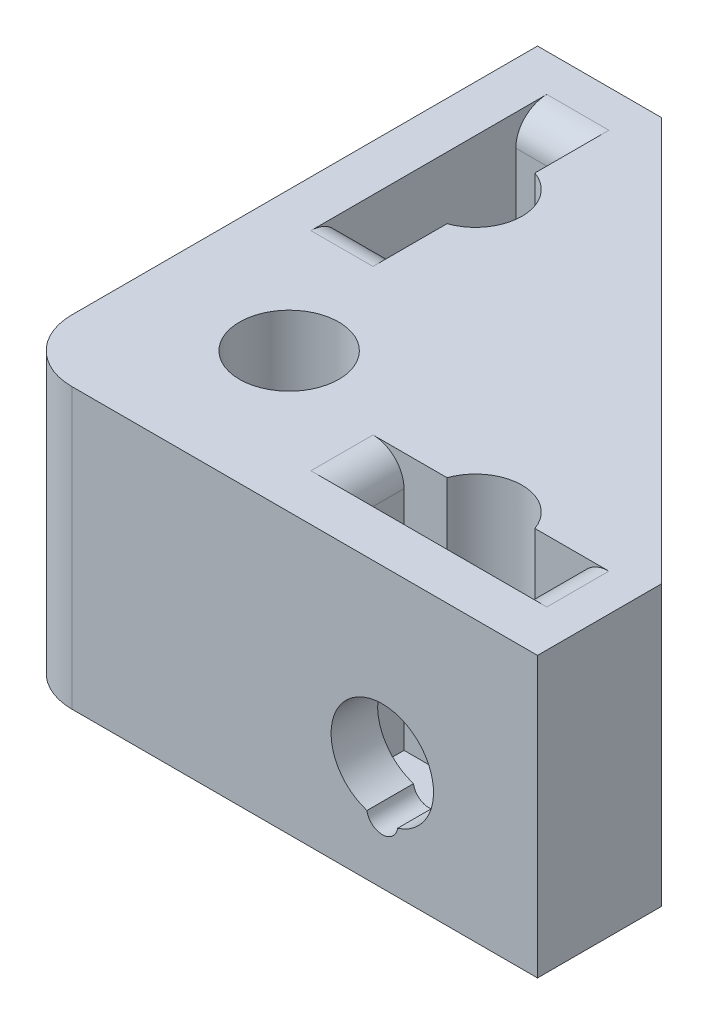
from build123d import *

# Parameters (mm, degrees)
BOSS_EXTRUDE1_DEPTH     = 9
SKETCH2_W               = 5.6
SKETCH2_H               = 2
CUT_EXTRUDE1_DEPTH      = 8.3
CUT_EXTRUDE2_DEPTH      = 22.914607001
CUT_EXTRUDE5_REACH      = 23.915
CUT_EXTRUDE5_END_RADIUS = 1.65
SKETCH16_R              = 1.5
FILLET2_R               = 1
SKETCH6_R               = 1.6
CUT_EXTRUDE3_DEPTH      = 22.914607049
CUT_EXTRUDE4_DEPTH      = 3
FILLET3_R               = 1
FILLET1_R               = 2


with BuildPart() as part:
    # Sketch1 → Boss-Extrude1 (new body)
    with BuildSketch(Plane(origin=(0, 0, 0), x_dir=(1, 0, 0), z_dir=(0, 1, 0))):
        Polygon((10.5, 10.5), (17, 4), (17, 0), (0, 0), align=None)
    extrude(amount=BOSS_EXTRUDE1_DEPTH)

    # Sketch2 → Cut-Extrude1 (cut)
    with BuildSketch(Plane(origin=(0, 9, 0), x_dir=(1, 0, 0), z_dir=(0, 1, 0))):
        with Locations((12, 2.5)):
            Rectangle(SKETCH2_W, SKETCH2_H)
    extrude(amount=-CUT_EXTRUDE1_DEPTH, mode=Mode.SUBTRACT)

    # Sketch4 → Cut-Extrude2 (cut, through all)
    with BuildSketch(Plane.XY):
        with BuildLine():
            ThreePointArc((12.49446871, 1.925833333), (12, 5.15), (11.50553129, 1.925833333))
            ThreePointArc((11.50553129, 1.925833333), (12, 1.5), (12.49446871, 1.925833333))
        make_face()
    extrude(amount=-CUT_EXTRUDE2_DEPTH, mode=Mode.SUBTRACT)

    # Cut-Extrude5: up to this cylinder (the profile starts outside it)
    cut_extrude5_end = Plane(origin=(12, 3.5, -3), z_dir=(0, 0, 1)) * Cylinder(CUT_EXTRUDE5_END_RADIUS, 52.13, mode=Mode.PRIVATE)
    # Sketch16 → Cut-Extrude5 (cut, up to the surface)
    with BuildSketch(Plane(origin=(0, 9, 0), x_dir=(1, 0, 0), z_dir=(0, 1, 0)), mode=Mode.PRIVATE) as cut_extrude5_sk1:
        with Locations((12, 3)):
            Circle(SKETCH16_R)
    cut_extrude5_tool1 = extrude(cut_extrude5_sk1.sketch, amount=-CUT_EXTRUDE5_REACH, mode=Mode.PRIVATE) - cut_extrude5_end
    add(cut_extrude5_tool1.solids().sort_by_distance((12, 9, -3))[0], mode=Mode.SUBTRACT)

    # Fillet2
    fillet2_edges = [part.edges().sort_by_distance(p)[0] for p in [
        (14.8, 9, -2.5),
        (9.2, 9, -2.5),
    ]]
    fillet(fillet2_edges, radius=FILLET2_R)

    # Sketch6 → Cut-Extrude3 (cut, through all)
    with BuildSketch(Plane(origin=(0, 9, 0), x_dir=(1, 0, 0), z_dir=(0, 1, 0))):
        with Locations((4.5, 4.5)):
            Circle(SKETCH6_R)
    extrude(amount=-CUT_EXTRUDE3_DEPTH, mode=Mode.SUBTRACT)

    # Sketch9 → Cut-Extrude4 (cut)
    with BuildSketch(Plane.XZ):
        Polygon((7.511458693, -5.306917925), (6.704540769, -2.295459231), (3.693082075, -1.488541307), (1.488541307, -3.693082075), (2.295459231, -6.704540769), (5.306917925, -7.511458693), align=None)
    extrude(amount=-CUT_EXTRUDE4_DEPTH, mode=Mode.SUBTRACT)

    # Fillet3
    fillet3_edges = [part.edges().sort_by_distance(p)[0] for p in [
        (6.960323501, 0, -5.858053117),
        (7.107999731, 0, -3.801188578),
        (5.198811422, 0, -1.892000269),
        (3.141946883, 0, -2.039676499),
    ]]
    fillet(fillet3_edges, radius=FILLET3_R)

    # Mirror1: part across plane


with BuildPart() as part_1:
    add(part.part)
    add(part.part.mirror(Plane(origin=(0, 9, 0), x_dir=(-0.7071067811865432, 0, 0.7071067811865518), z_dir=(0.707106781186552, 0, 0.7071067811865431))))

    # Fillet1
    fillet1_edges = [part_1.edges().sort_by_distance(p)[0] for p in [
        (0, 4.5, 0),
    ]]
    fillet(fillet1_edges, radius=FILLET1_R)


solid = part_1.part
